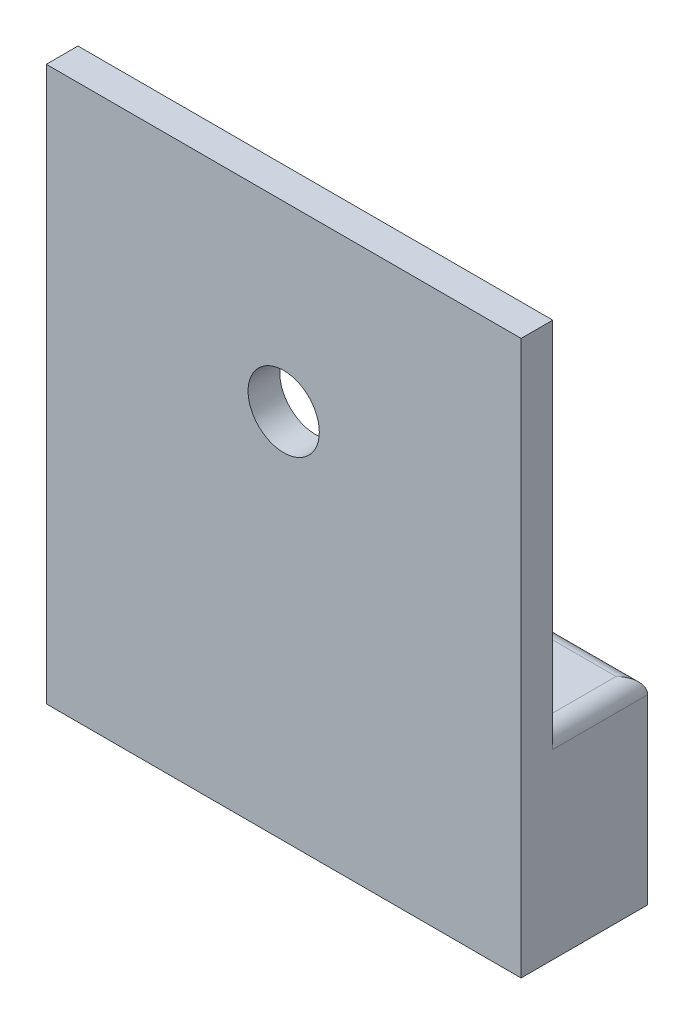
from build123d import *

# Parameters (mm, degrees)
SKETCH2_W           = 60
SKETCH2_H           = 70
SKETCH2_R           = 4.5
BOSS_EXTRUDE1_DEPTH = 4
SKETCH3_W           = 60
SKETCH3_H           = 25
BOSS_EXTRUDE2_DEPTH = 12
FILLET1_R           = 2
SKETCH4_R           = 2.5
CUT_EXTRUDE1_DEPTH  = 28


with BuildPart() as part:
    # Sketch2 → Boss-Extrude1 (new body)
    with BuildSketch(Plane.XY):
        with Locations((-11.05214497, -10.673076923)):
            Rectangle(SKETCH2_W, SKETCH2_H)
        with Locations((-11.05214497, 1.316923077)):
            Circle(SKETCH2_R, mode=Mode.SUBTRACT)
    extrude(amount=BOSS_EXTRUDE1_DEPTH)

    # Sketch3 → Boss-Extrude2 (add)
    with BuildSketch(Plane(origin=(0, 0, 0), x_dir=(-1, 0, 0), z_dir=(0, 0, -1))):
        with Locations((11.05214497, -33.173076923)):
            Rectangle(SKETCH3_W, SKETCH3_H)
    extrude(amount=BOSS_EXTRUDE2_DEPTH)

    # Fillet1
    fillet1_edges = [part.edges().sort_by_distance(p)[0] for p in [
        (-41.05214497, -20.673076923, -6),
        (18.94785503, -20.673076923, -6),
        (-11.05214497, -20.673076923, -12),
    ]]
    fillet(fillet1_edges, radius=FILLET1_R)

    # Sketch4 → Cut-Extrude1 (cut)
    with BuildSketch(Plane(origin=(0, -20.673076923, 0), x_dir=(1, 0, 0), z_dir=(0, 1, 0))):
        with Locations(Location((-29.05214497, 5, 0), (0, 0, 270))):
            Circle(SKETCH4_R)
        with Locations(Location((6.94785503, 5, 0), (0, 0, 270))):
            Circle(SKETCH4_R)
    extrude(amount=-CUT_EXTRUDE1_DEPTH, mode=Mode.SUBTRACT)


solid = part.part
